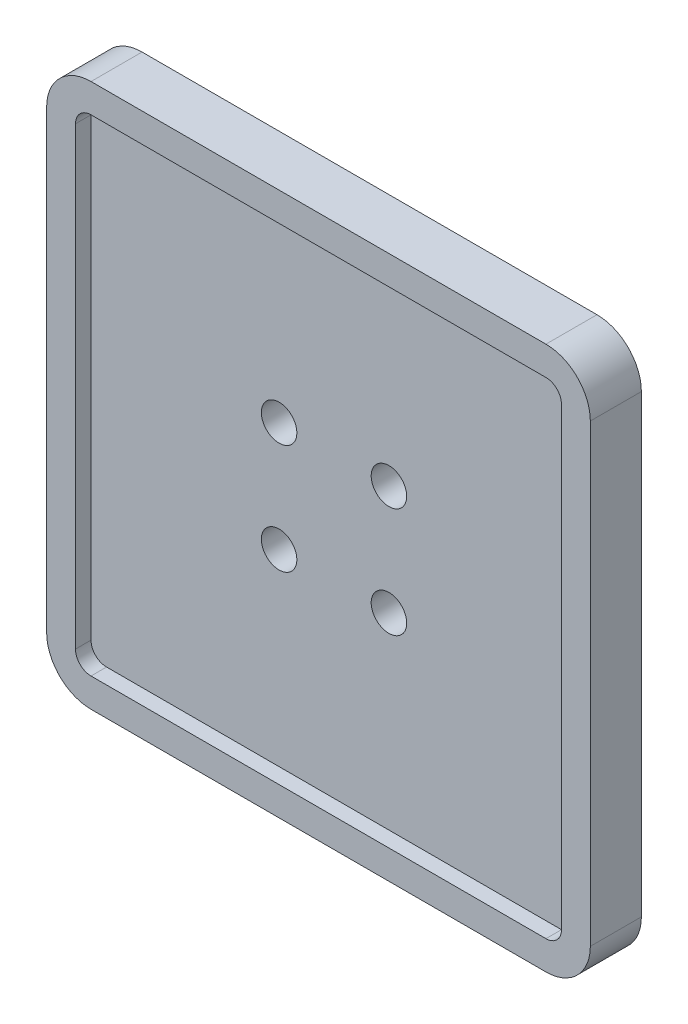
from build123d import *

# Parameters (mm, degrees)
SKETCH1_R           = 1.6
BOSS_EXTRUDE1_DEPTH = 4.6
CUT_EXTRUDE5_DEPTH  = 1.4


with BuildPart() as part:
    # Sketch1 → Boss-Extrude1 (new body)
    with BuildSketch(Plane.XY):
        with BuildLine():
            Line((-24.5, -20.5), (-24.5, 20.5))
            ThreePointArc((-24.5, 20.5), (-23.328427125, 23.328427125), (-20.5, 24.5))
            Line((-20.5, 24.5), (20.5, 24.5))
            ThreePointArc((20.5, 24.5), (23.328427125, 23.328427125), (24.5, 20.5))
            Line((24.5, 20.5), (24.5, -20.5))
            ThreePointArc((24.5, -20.5), (23.328427125, -23.328427125), (20.5, -24.5))
            Line((20.5, -24.5), (-20.5, -24.5))
            ThreePointArc((-20.5, -24.5), (-23.328427125, -23.328427125), (-24.5, -20.5))
        make_face()
        with Locations((-4.949747468, 4.949747468)):
            Circle(SKETCH1_R, mode=Mode.SUBTRACT)
        with Locations((4.949747468, 4.949747468)):
            Circle(SKETCH1_R, mode=Mode.SUBTRACT)
        with Locations((4.949747468, -4.949747468)):
            Circle(SKETCH1_R, mode=Mode.SUBTRACT)
        with Locations((-4.949747468, -4.949747468)):
            Circle(SKETCH1_R, mode=Mode.SUBTRACT)
    extrude(amount=BOSS_EXTRUDE1_DEPTH)

    # Sketch5 → Cut-Extrude5 (cut)
    with BuildSketch(Plane.XY.offset(4.6)):
        with BuildLine():
            Line((21.9, -20.5), (21.9, 20.5))
            ThreePointArc((21.9, 20.5), (21.489949494, 21.489949494), (20.5, 21.9))
            Line((20.5, 21.9), (-20.5, 21.9))
            ThreePointArc((-20.5, 21.9), (-21.489949494, 21.489949494), (-21.9, 20.5))
            Line((-21.9, 20.5), (-21.9, -20.5))
            ThreePointArc((-21.9, -20.5), (-21.489949494, -21.489949494), (-20.5, -21.9))
            Line((-20.5, -21.9), (20.5, -21.9))
            ThreePointArc((20.5, -21.9), (21.489949494, -21.489949494), (21.9, -20.5))
        make_face()
    extrude(amount=-CUT_EXTRUDE5_DEPTH, mode=Mode.SUBTRACT)


solid = part.part
